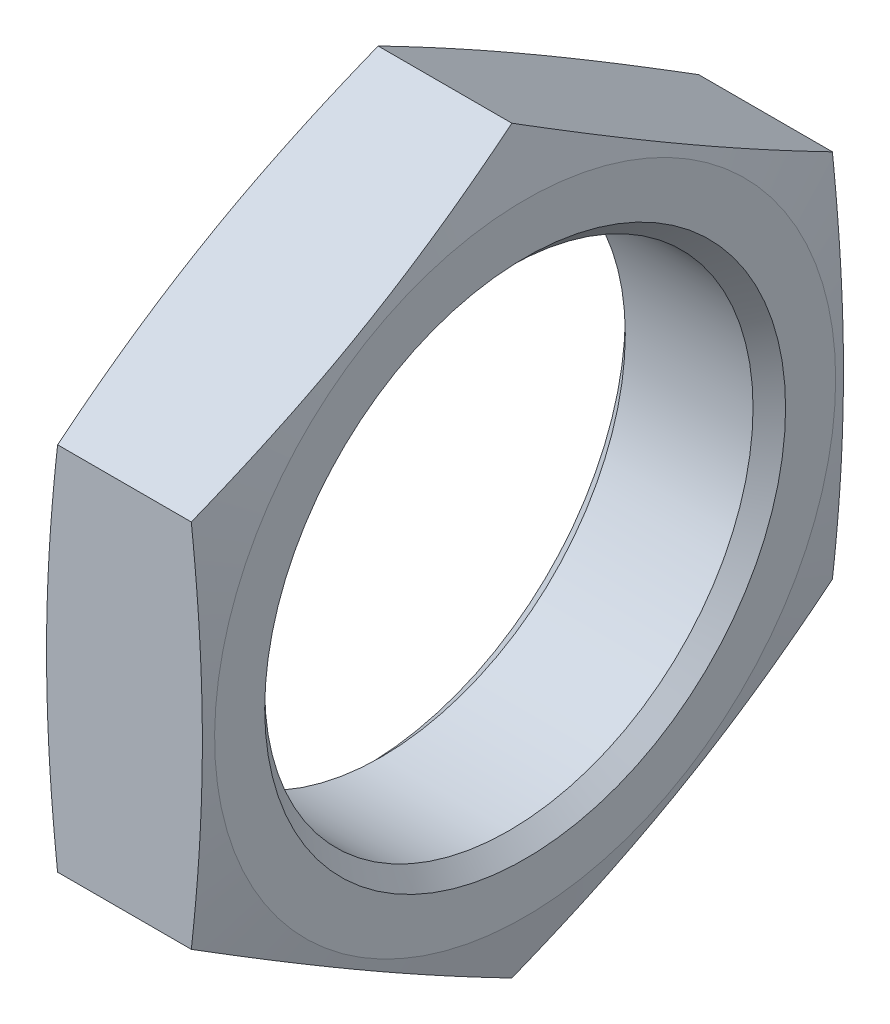
from build123d import *

# Parameters (mm, degrees)
SKETCH_2_R          = 48
CUT_EXTRUDE_1_DEPTH = 8


with BuildPart() as part:
    # 草图1 → 旋转1 (revolve)
    with BuildSketch(Plane.XY):
        Polygon((0, -15.5), (3.5, -31.2), (4.5, -31.2), (8, -15.5), (8, -13), (7.188, -12.188), (0.812, -12.188), (0, -13), align=None)
    revolve(axis=Axis((0, 0, 0), (1, 0, 0)))

    # 草图2 → 切除-拉伸1 (cut)
    with BuildSketch(Plane(origin=(0, 0, 0), x_dir=(0, 0, -1), z_dir=(1, 0, 0))):
        Circle(SKETCH_2_R)
        Polygon((-16, 9.237604307), (-16, -9.237604307), (0, -18.475208614), (16, -9.237604307), (16, 9.237604307), (0, 18.475208614), align=None, mode=Mode.SUBTRACT)
    extrude(amount=CUT_EXTRUDE_1_DEPTH, mode=Mode.SUBTRACT)


solid = part.part
